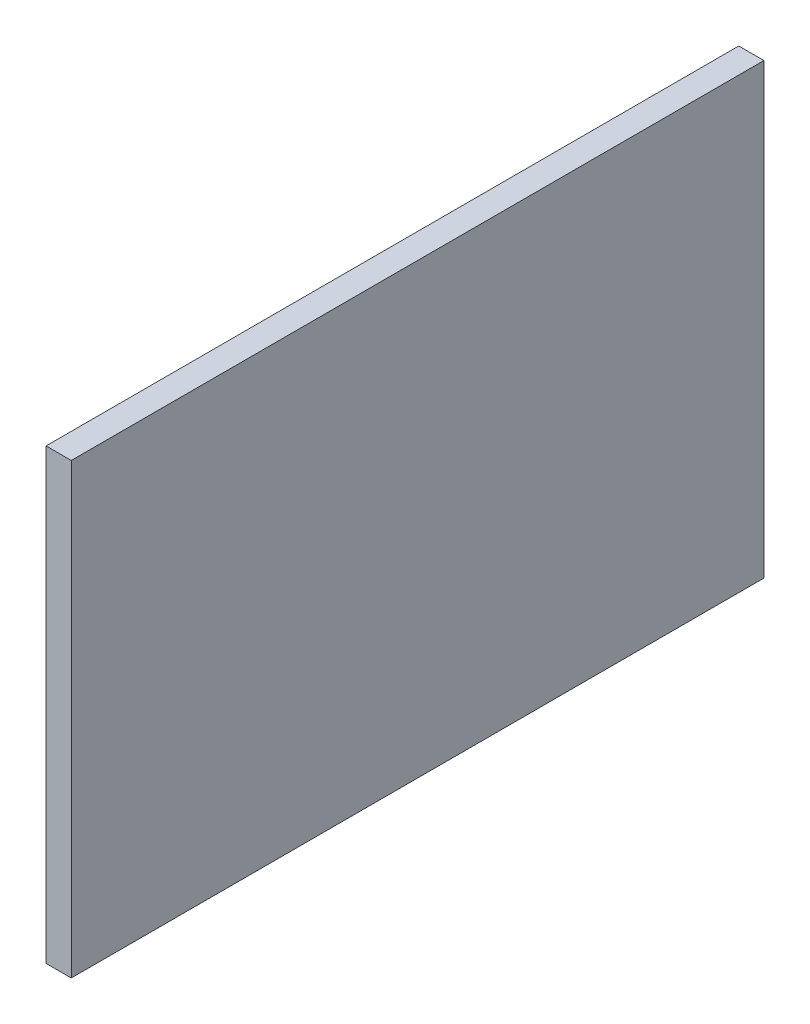
from build123d import *

# Parameters (mm, degrees)
IZIM1_W                     = 275
IZIM1_H                     = 177.95
Y_KSEKLIK_EKSTR_ZYON1_DEPTH = 10


with BuildPart() as part:
    # Çizim1 → Yükseklik-Ekstrüzyon1 (new body)
    with BuildSketch(Plane(origin=(0, 0, 0), x_dir=(0, 0, -1), z_dir=(1, 0, 0))):
        with Locations((137.5, 88.975)):
            Rectangle(IZIM1_W, IZIM1_H)
    extrude(amount=Y_KSEKLIK_EKSTR_ZYON1_DEPTH)


solid = part.part
